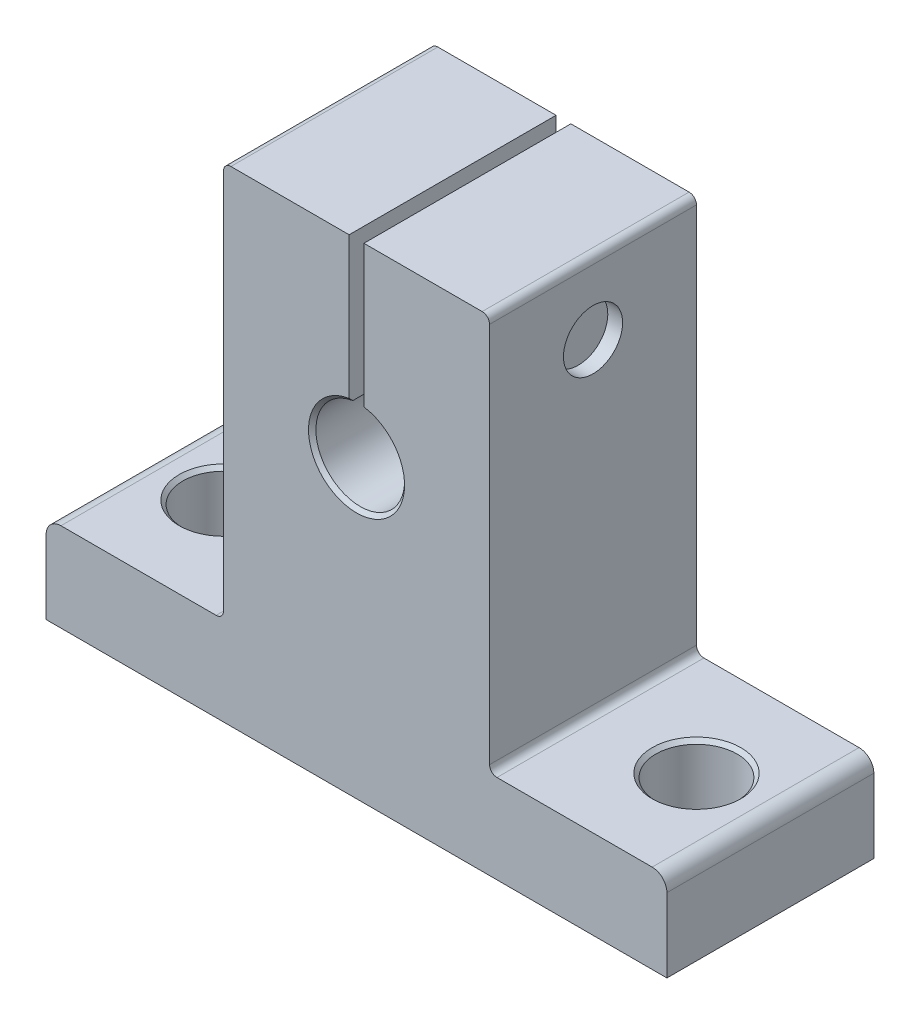
from build123d import *

# Parameters (mm, degrees)
BOSS_EXTRUDE1_DEPTH     = 14
CUT_EXTRUDE1_DEPTH      = 42.386471219
CUT_EXTRUDE1_DEPTH_BACK = 6
SKETCH3_R               = 2.75
FILLET1_R               = 1
FILLET2_R               = 0.5
CHAMFER1_SIZE           = 0.25
SKETCH4_R               = 3.1
CUT_EXTRUDE2_DEPTH      = 1
SKETCH5_R               = 3.1
SKETCH5_R_2             = 3
CUT_EXTRUDE3_DEPTH      = 4
CHAMFER2_SIZE           = 0.2
CUT_EXTRUDE4_DEPTH      = 2
SKETCH7_R               = 2
BOSS_EXTRUDE2_DEPTH     = 1
CUT_EXTRUDE5_START      = -1
SKETCH8_R               = 2
CUT_EXTRUDE5_DEPTH      = 1
SKETCH9_R               = 1.732050808
CUT_EXTRUDE6_DEPTH      = 1
CUT_EXTRUDE6_DRAFT      = -45


with BuildPart() as part:
    # Sketch1 → Boss-Extrude1 (new body)
    with BuildSketch(Plane.XY):
        with BuildLine():
            Line((-21, 0), (21, 0))
            Line((21, 0), (21, 6))
            Line((21, 6), (9, 6))
            Line((9, 6), (9, 32.8))
            Line((9, 32.8), (0.5, 32.8))
            Line((0.5, 32.8), (0.5, 22.958039892))
            ThreePointArc((0.5, 22.958039892), (0, 17), (-0.5, 22.958039892))
            Line((-0.5, 22.958039892), (-0.5, 32.8))
            Line((-0.5, 32.8), (-9, 32.8))
            Line((-9, 32.8), (-9, 6))
            Line((-9, 6), (-21, 6))
            Line((-21, 6), (-21, 0))
        make_face()
    extrude(amount=BOSS_EXTRUDE1_DEPTH)

    # Sketch3 → Cut-Extrude1 (cut, two sides: drawn at the far end of the back side and taken through both)
    with BuildSketch(Plane.XZ.offset(-CUT_EXTRUDE1_DEPTH_BACK)):
        with Locations(Location((-16, 7, 0), (0, 0, 180))):
            Circle(SKETCH3_R)
        with Locations(Location((16, 7, 0), (0, 0, 180))):
            Circle(SKETCH3_R)
    extrude(amount=CUT_EXTRUDE1_DEPTH + CUT_EXTRUDE1_DEPTH_BACK, mode=Mode.SUBTRACT)

    # Fillet1
    fillet1_edges = [part.edges().sort_by_distance(p)[0] for p in [
        (-21, 6, 7),
        (21, 6, 7),
    ]]
    fillet(fillet1_edges, radius=FILLET1_R)

    # Fillet2
    fillet2_edges = [part.edges().sort_by_distance(p)[0] for p in [
        (-9, 6, 7),
        (-9, 32.8, 7),
        (9, 32.8, 7),
        (9, 6, 7),
    ]]
    fillet(fillet2_edges, radius=FILLET2_R)

    # Chamfer1
    chamfer1_edges = [part.edges().sort_by_distance(p)[0] for p in [
        (0, 17, 0),
        (0, 17, 14),
        (18.75, 6, 7),
        (18.75, 0, 7),
        (-13.25, 6, 7),
        (-13.25, 0, 7),
    ]]
    chamfer(chamfer1_edges, length=CHAMFER1_SIZE)

    # Sketch4 → Cut-Extrude2 (cut)
    with BuildSketch(Plane.ZY.offset(9)):
        with Locations(Location((7, 27.9, 0), (0, 0, 270))):
            Circle(SKETCH4_R)
    extrude(amount=-CUT_EXTRUDE2_DEPTH, mode=Mode.SUBTRACT)

    # Sketch5 → Cut-Extrude3 (cut)
    with BuildSketch(Plane.ZY.offset(8)):
        with Locations(Location((7, 27.9, 0), (0, 0, 270))):
            Circle(SKETCH5_R)
        with Locations(Location((7, 27.9, 0), (0, 0, 270))):
            Circle(SKETCH5_R_2, mode=Mode.SUBTRACT)
    extrude(amount=-CUT_EXTRUDE3_DEPTH, mode=Mode.SUBTRACT)

    # Chamfer2
    chamfer2_edges = [part.edges().sort_by_distance(p)[0] for p in [
        (-8, 30.9, 7),
    ]]
    chamfer(chamfer2_edges, length=CHAMFER2_SIZE)

    # Sketch6 → Cut-Extrude4 (cut)
    with BuildSketch(Plane.ZY.offset(8)):
        Polygon((7.114499964, 29.628262063), (5.560531131, 28.863290909), (5.446031167, 27.135028846), (6.885500036, 26.171737937), (8.439468869, 26.936709091), (8.553968833, 28.664971154), align=None)
    extrude(amount=-CUT_EXTRUDE4_DEPTH, mode=Mode.SUBTRACT)

    # Sketch7 → Boss-Extrude2 (add)
    with BuildSketch(Plane(origin=(-0.5, 0, 0), x_dir=(0, 0, -1), z_dir=(1, 0, 0))):
        with Locations(Location((-7, 27.9, 0), (0, 0, 270))):
            Circle(SKETCH7_R)
    extrude(amount=BOSS_EXTRUDE2_DEPTH)

    # Sketch8 → Cut-Extrude5 (cut)
    with BuildSketch(Plane(origin=(9, 0, 0), x_dir=(0, 0, -1), z_dir=(1, 0, 0)).offset(CUT_EXTRUDE5_START)):
        with Locations(Location((-7, 27.9, 0), (0, 0, 270))):
            Circle(SKETCH8_R)
    extrude(amount=CUT_EXTRUDE5_DEPTH, mode=Mode.SUBTRACT)


with BuildPart() as cut_extrude6_tool:
    # Sketch9 → Cut-Extrude6 (with draft: the straight prism first)
    with BuildSketch(Plane.ZY.offset(8)):
        with Locations((7, 27.9)):
            Circle(SKETCH9_R)
    extrude(amount=-CUT_EXTRUDE6_DEPTH)
    # Cut-Extrude6: the draft: its side faces are tilted about the plane it starts from
    cut_extrude6_sides = [cut_extrude6_tool.faces().sort_by_distance(p)[0] for p in [
        (-7.5, 27.9, 5.267949192),
    ]]
    draft(cut_extrude6_sides, Plane.ZY.offset(8), CUT_EXTRUDE6_DRAFT)


with BuildPart() as part_1:
    add(part.part)

    # Cut-Extrude6: cut by cut_extrude6_tool
    add(cut_extrude6_tool.part, mode=Mode.SUBTRACT)


solid = part_1.part
